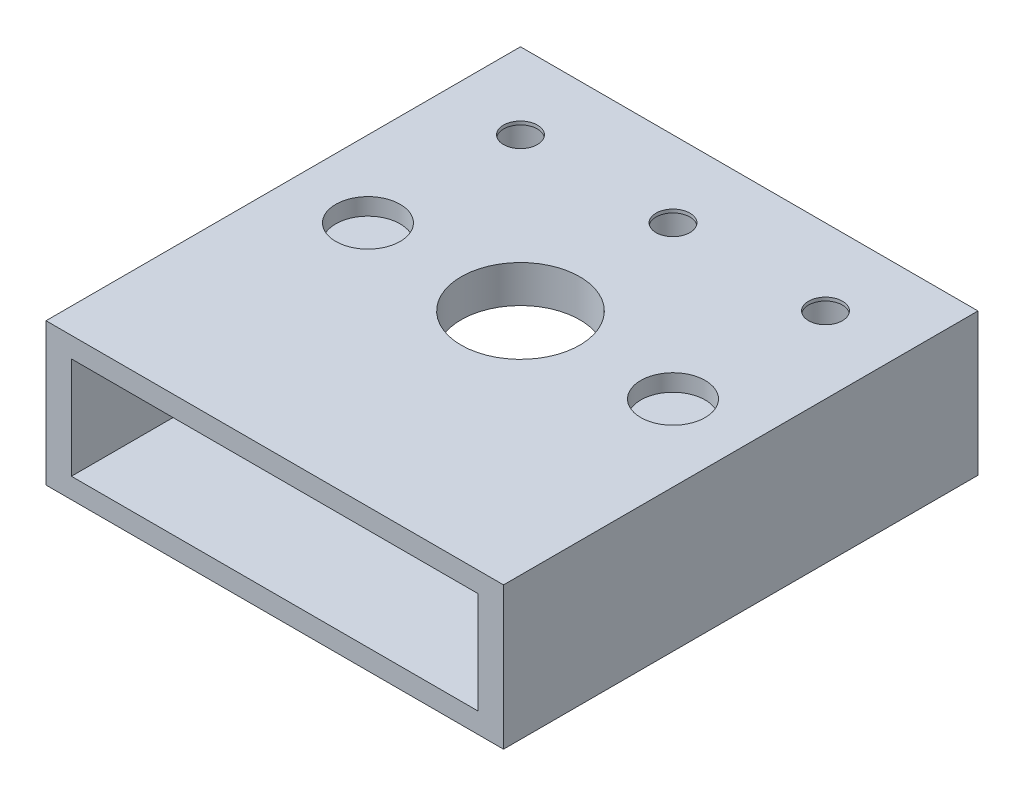
from build123d import *

# Parameters (mm, degrees)
SKETCH1_W               = 135
SKETCH1_H               = 90
SKETCH1_R               = 17.5
BOSS_EXTRUDE1_DEPTH     = 11
SKETCH3_R               = 9.5
CUT_EXTRUDE1_DEPTH      = 5
CUT_EXTRUDE2_DEPTH      = 82.867270628
CUT_EXTRUDE2_DEPTH_BACK = 82.867270628
SKETCH5_R               = 5
SKETCH6_R               = 8
CUT_EXTRUDE3_DEPTH      = 10
SKETCH7_W               = 135
SKETCH7_H               = 90
SKETCH7_W_2             = 110
SKETCH7_H_2             = 82
BOSS_EXTRUDE2_DEPTH     = 31
SKETCH8_W               = 135
SKETCH8_H               = 42
BOSS_EXTRUDE3_DEPTH     = 50
SKETCH9_W               = 120
SKETCH9_H               = 30
CUT_EXTRUDE4_DEPTH      = 35
SKETCH10_R              = 5
CUT_EXTRUDE5_DEPTH      = 101
SKETCH11_R              = 8
CUT_EXTRUDE6_DEPTH      = 10


with BuildPart() as part:
    # Sketch1 → Boss-Extrude1 (new body)
    with BuildSketch(Plane(origin=(0, 0, 0), x_dir=(1, 0, 0), z_dir=(0, 1, 0))):
        Rectangle(SKETCH1_W, SKETCH1_H)
        with Locations(Location((0, -22.5, 0), (0, 0, 270))):
            Circle(SKETCH1_R, mode=Mode.SUBTRACT)
    extrude(amount=BOSS_EXTRUDE1_DEPTH)

    # Sketch3 → Cut-Extrude1 (cut)
    with BuildSketch(Plane(origin=(0, 11, 0), x_dir=(1, 0, 0), z_dir=(0, 1, 0))):
        with Locations(Location((45, -22.5, 0), (0, 0, 270))):
            Circle(SKETCH3_R)
        with Locations(Location((-45, -22.5, 0), (0, 0, 270))):
            Circle(SKETCH3_R)
    extrude(amount=-CUT_EXTRUDE1_DEPTH, mode=Mode.SUBTRACT)

    # Sketch5 → Cut-Extrude2 (cut, two sides: drawn at the far end of the back side and taken through both)
    with BuildSketch(Plane(origin=(0, 11, 0), x_dir=(1, 0, 0), z_dir=(0, 1, 0)).offset(-CUT_EXTRUDE2_DEPTH_BACK)):
        with Locations(Location((0, 22.5, 0), (0, 0, 270))):
            Circle(SKETCH5_R)
        with Locations(Location((45, 22.5, 0), (0, 0, 270))):
            Circle(SKETCH5_R)
        with Locations(Location((-45, 22.5, 0), (0, 0, 270))):
            Circle(SKETCH5_R)
    extrude(amount=CUT_EXTRUDE2_DEPTH + CUT_EXTRUDE2_DEPTH_BACK, mode=Mode.SUBTRACT)

    # Sketch6 → Cut-Extrude3 (cut)
    with BuildSketch(Plane.XZ):
        with Locations(Location((45, -22.5, 0), (0, 0, 270))):
            Circle(SKETCH6_R)
        with Locations(Location((0, -22.5, 0), (0, 0, 270))):
            Circle(SKETCH6_R)
        with Locations(Location((-45, -22.5, 0), (0, 0, 90))):
            Circle(SKETCH6_R)
    extrude(amount=-CUT_EXTRUDE3_DEPTH, mode=Mode.SUBTRACT)

    # Sketch7 → Boss-Extrude2 (add)
    with BuildSketch(Plane.XZ):
        Rectangle(SKETCH7_W, SKETCH7_H)
        Rectangle(SKETCH7_W_2, SKETCH7_H_2, mode=Mode.SUBTRACT)
    extrude(amount=BOSS_EXTRUDE2_DEPTH)

    # Sketch8 → Boss-Extrude3 (add)
    with BuildSketch(Plane.XY.offset(45)):
        with Locations((0, -10)):
            Rectangle(SKETCH8_W, SKETCH8_H)
    extrude(amount=BOSS_EXTRUDE3_DEPTH)

    # Sketch9 → Cut-Extrude4 (cut)
    with BuildSketch(Plane.XY.offset(95)):
        with Locations((0, -10)):
            Rectangle(SKETCH9_W, SKETCH9_H)
    extrude(amount=-CUT_EXTRUDE4_DEPTH, mode=Mode.SUBTRACT)

    # Sketch10 → Cut-Extrude5 (cut)
    with BuildSketch(Plane.XY.offset(60)):
        with Locations((-40, -10)):
            Circle(SKETCH10_R)
        with Locations(Location((40, -10, 0), (0, 0, 180))):
            Circle(SKETCH10_R)
        with Locations((0, -10)):
            Circle(SKETCH10_R)
    extrude(amount=-CUT_EXTRUDE5_DEPTH, mode=Mode.SUBTRACT)

    # Sketch11 → Cut-Extrude6 (cut)
    with BuildSketch(Plane(origin=(0, 0, 41), x_dir=(-1, 0, 0), z_dir=(0, 0, -1))):
        with Locations((0, -10)):
            Circle(SKETCH11_R)
        with Locations((-40, -10)):
            Circle(SKETCH11_R)
        with Locations((40, -10)):
            Circle(SKETCH11_R)
    extrude(amount=-CUT_EXTRUDE6_DEPTH, mode=Mode.SUBTRACT)


solid = part.part
